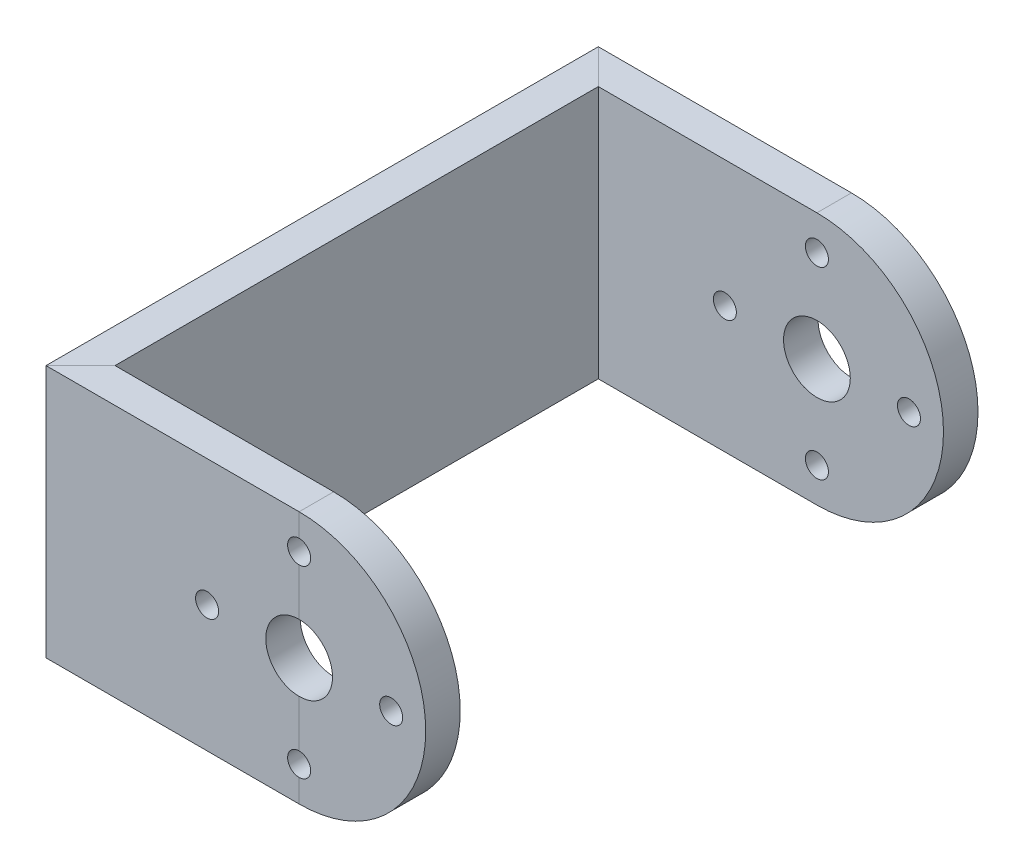
from build123d import *

# Parameters (mm, degrees)
SKETCH3_W               = 3
SKETCH3_H               = 22
CUT_EXTRUDE1_DEPTH      = 35.365680555
CUT_EXTRUDE1_DEPTH_BACK = 35.365680555
SKETCH1_R               = 1
SKETCH1_R_2             = 2.9


with BuildPart() as part:
    # Sweep1: sweep along a path in Sketch2
    with BuildLine(Plane(origin=(0, 0, 0), x_dir=(1, 0, 0), z_dir=(0, 1, 0))) as sweep1_path:
        Line((11, -21), (0, -21))
        Line((0, -21), (-19, -21))
        Line((-19, -21), (-19, 21))
        Line((-19, 21), (0, 21))
        Line((0, 21), (11, 21))
    # Sketch3 → Sweep1 (sweep)
    with BuildSketch(Plane(origin=(0, 0, 0), x_dir=(0, 0, -1), z_dir=(1, 0, 0))):
        with Locations((22.5, 0)):
            Rectangle(SKETCH3_W, SKETCH3_H)
    sweep(path=sweep1_path.line, transition=Transition.RIGHT)

    # Sketch1 → Cut-Extrude1 (cut, two sides: drawn at the far end of the back side and taken through both)
    with BuildSketch(Plane.XY.offset(-CUT_EXTRUDE1_DEPTH_BACK)):
        with BuildLine():
            Line((11, 11), (0, 11))
            ThreePointArc((0, 11), (7.778174593, 7.778174593), (11, 0))
            Line((11, 0), (11, 11))
        make_face()
        with Locations((8, 0)):
            Circle(SKETCH1_R)
        with Locations(Location((0, -8, 0), (0, 0, 270))):
            Circle(SKETCH1_R)
        with Locations(Location((0, 0, 0), (0, 0, 270))):
            Circle(SKETCH1_R_2)
        with BuildLine():
            Line((11, -11), (11, 0))
            ThreePointArc((11, 0), (7.778174593, -7.778174593), (0, -11))
            Line((0, -11), (11, -11))
        make_face()
        with Locations(Location((0, 8, 0), (0, 0, 270))):
            Circle(SKETCH1_R)
        with Locations((-8, 0)):
            Circle(SKETCH1_R)
    extrude(amount=CUT_EXTRUDE1_DEPTH + CUT_EXTRUDE1_DEPTH_BACK, mode=Mode.SUBTRACT)


solid = part.part
